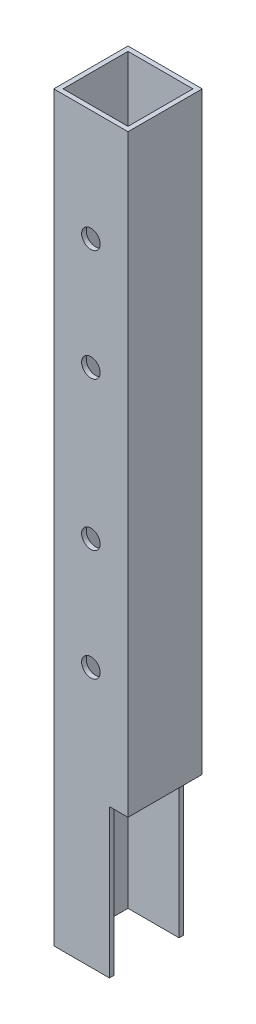
from build123d import *

# Parameters (mm, degrees)
SKETCH1_W           = 25.4
SKETCH1_H           = 25.4
SKETCH1_W_2         = 22.225
SKETCH1_H_2         = 22.225
BOSS_EXTRUDE1_DEPTH = 101.6
SKETCH4_R           = 3.175
CUT_EXTRUDE3_DEPTH  = 25.4
SKETCH5_R           = 3.175
CUT_EXTRUDE4_DEPTH  = 25.4
BOSS_EXTRUDE2_DEPTH = 50.8


with BuildPart() as part:
    # Sketch1 → Boss-Extrude1 (new, symmetric)
    with BuildSketch(Plane(origin=(0, 0, 0), x_dir=(1, 0, 0), z_dir=(0, 1, 0))):
        Rectangle(SKETCH1_W, SKETCH1_H)
        Rectangle(SKETCH1_W_2, SKETCH1_H_2, mode=Mode.SUBTRACT)
    extrude(amount=BOSS_EXTRUDE1_DEPTH, both=True)

    # Sketch4 → Cut-Extrude3 (cut)
    with BuildSketch(Plane.XY.offset(12.7)):
        with Locations((0, 63.5)):
            Circle(SKETCH4_R)
        with Locations((0, -63.5)):
            Circle(SKETCH4_R)
    extrude(amount=-CUT_EXTRUDE3_DEPTH, mode=Mode.SUBTRACT)

    # Sketch5 → Cut-Extrude4 (cut)
    with BuildSketch(Plane.XY.offset(12.7)):
        with Locations((0, 25.4)):
            Circle(SKETCH5_R)
        with Locations((0, -25.4)):
            Circle(SKETCH5_R)
    extrude(amount=-CUT_EXTRUDE4_DEPTH, mode=Mode.SUBTRACT)

    # Sketch6 → Boss-Extrude2 (add)
    with BuildSketch(Plane.XZ.offset(101.6)):
        Polygon((6.35, -11.1125), (-11.1125, -11.1125), (-11.1125, 11.1125), (6.35, 11.1125), (6.35, 12.7), (-12.7, 12.7), (-12.7, -12.7), (6.35, -12.7), align=None)
    extrude(amount=BOSS_EXTRUDE2_DEPTH)


solid = part.part
